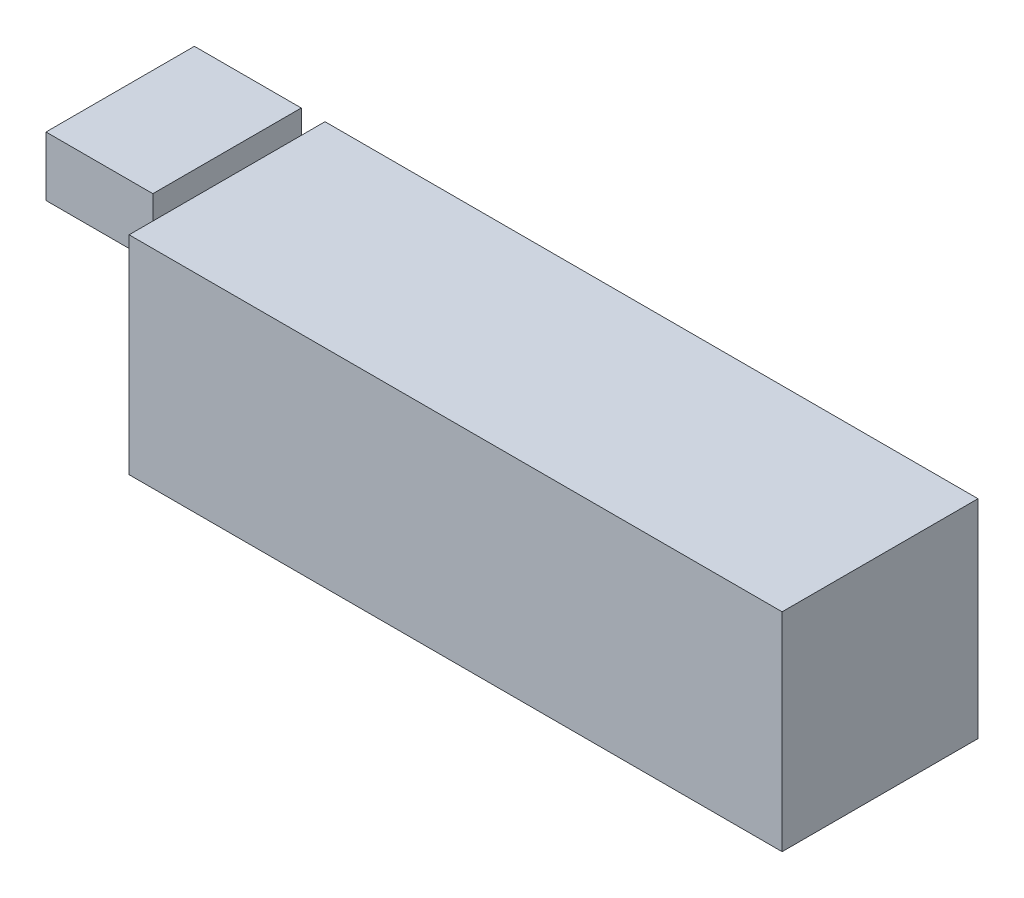
from build123d import *

# Parameters (mm, degrees)
SKETCH_1_W      = 110
SKETCH_1_H      = 35
EXTRUDE_1_DEPTH = 33
SKETCH_2_W      = 25
SKETCH_2_H      = 10
EXTRUDE_2_DEPTH = 18


with BuildPart() as part:
    # Эскиз1 → Бобышка-Вытянуть1 (new body)
    with BuildSketch(Plane.XY):
        with Locations((55, 17.5)):
            Rectangle(SKETCH_1_W, SKETCH_1_H)
    extrude(amount=EXTRUDE_1_DEPTH)

    # Эскиз2 → Бобышка-Вытянуть2 (add)
    with BuildSketch(Plane.ZY):
        with Locations((16.5, 34)):
            Rectangle(SKETCH_2_W, SKETCH_2_H)
    extrude(amount=EXTRUDE_2_DEPTH)


solid = part.part
